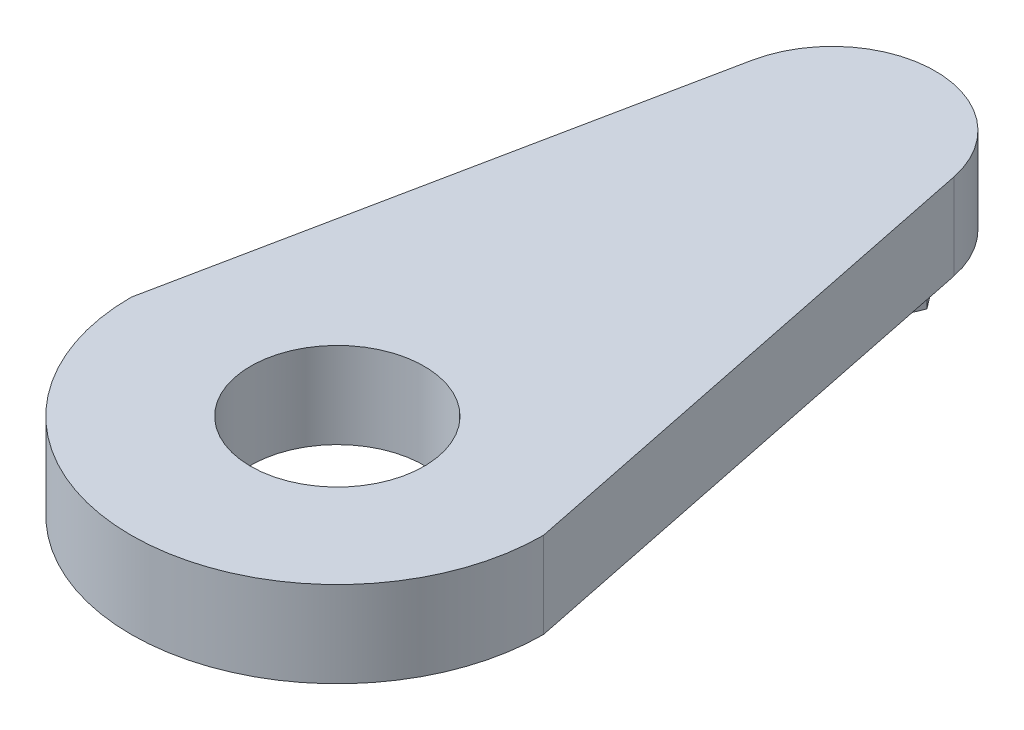
from build123d import *

# Parameters (mm, degrees)
SKETCH1_R           = 2.525
BOSS_EXTRUDE1_DEPTH = 2.5
SKETCH2_R           = 1.040591752
BOSS_EXTRUDE2_DEPTH = 1
BOSS_EXTRUDE3_DEPTH = 0.5


with BuildPart() as part:
    # Sketch1 → Boss-Extrude1 (new body)
    with BuildSketch(Plane(origin=(0, 0, 0), x_dir=(1, 0, 0), z_dir=(0, 1, 0))):
        with BuildLine():
            Line((-5.520391153, 2.350591738), (-6, 0))
            ThreePointArc((-6, 0), (0, -6), (6, 0))
            Line((6, 0), (5.520391153, 2.350591738))
            Line((5.520391153, 2.350591738), (2.939437593, 15))
            ThreePointArc((2.939437593, 15), (0, 17.40024452), (-2.939437593, 15))
            Line((-2.939437593, 15), (-5.520391153, 2.350591738))
        make_face()
        with Locations(Location((0, 0, 0), (0, 0, 270))):
            Circle(SKETCH1_R, mode=Mode.SUBTRACT)
    extrude(amount=BOSS_EXTRUDE1_DEPTH)

    # Sketch2 → Boss-Extrude2 (add)
    with BuildSketch(Plane.XZ):
        with Locations(Location((0, -15.039011309, 0), (0, 0, 90))):
            Circle(SKETCH2_R)
    extrude(amount=BOSS_EXTRUDE2_DEPTH)

    # Sketch3 → Boss-Extrude3 (add)
    with BuildSketch(Plane.XZ.offset(1)):
        Polygon((1.147373963, -13.536920287), (-0.727162002, -13.294310799), (-1.874535964, -14.79640182), (-1.147373963, -16.54110233), (0.727162002, -16.783711818), (1.874535964, -15.281620797), align=None)
    extrude(amount=BOSS_EXTRUDE3_DEPTH)


solid = part.part
